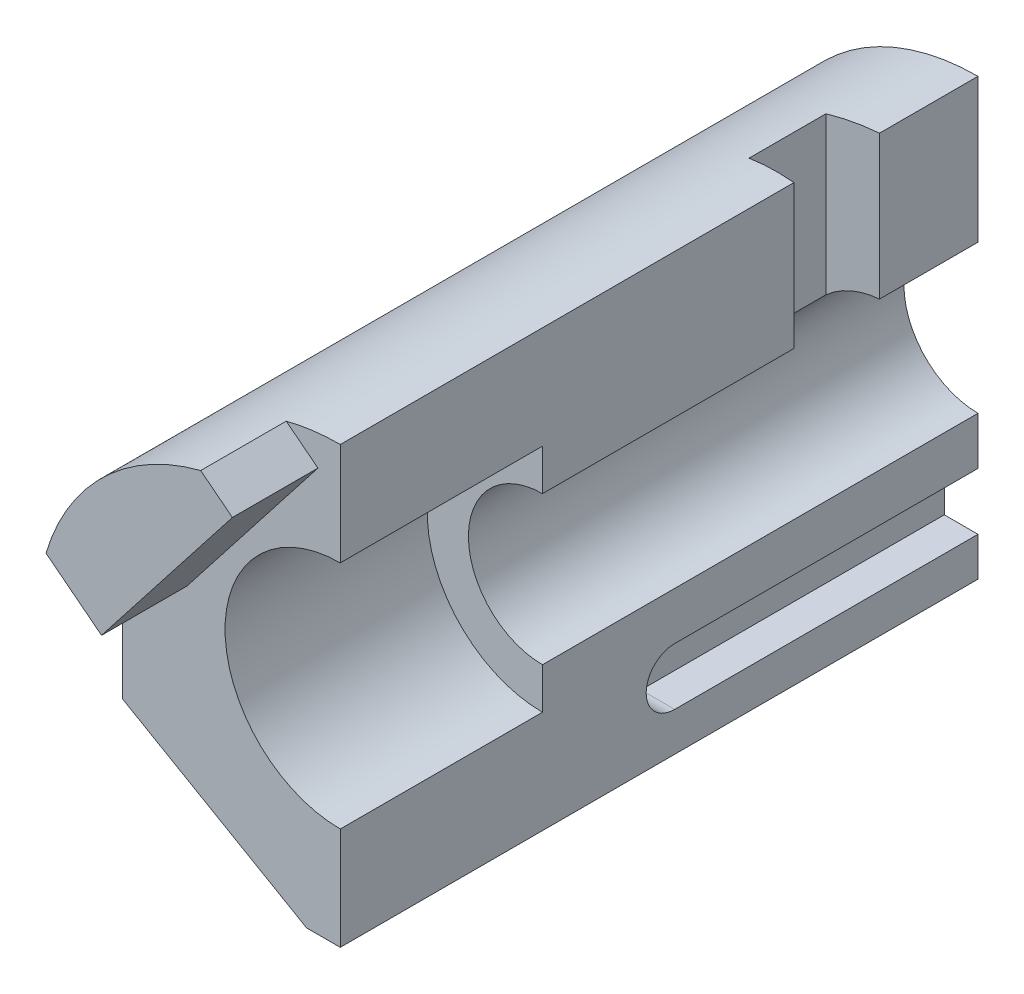
from build123d import *

# Parameters (mm, degrees)
BOSS_EXTRUDE1_DEPTH     = 246
CUT_EXTRUDE1_DEPTH      = 78
BOSS_EXTRUDE2_START     = 33
BOSS_EXTRUDE2_DEPTH     = 33
CUT_EXTRUDE4_DEPTH      = 13
CUT_EXTRUDE5_REACH      = 314.807
CUT_EXTRUDE5_END_RADIUS = 28.575


with BuildPart() as part:
    # Sketch2 → Boss-Extrude1 (new body)
    with BuildSketch(Plane.XY):
        with BuildLine():
            Line((0, -28.575), (0, -84))
            Line((0, -84), (-13, -84))
            Line((-13, -84), (-84, -43.008130888))
            Line((-84, -43.008130888), (-84, 0))
            ThreePointArc((-84, 0), (-59.39696962, 59.39696962), (0, 84))
            Line((0, 84), (0, 28.575))
            ThreePointArc((0, 28.575), (-28.575, 0), (0, -28.575))
        make_face()
    extrude(amount=-BOSS_EXTRUDE1_DEPTH)

    # Sketch3 → Cut-Extrude1 (cut)
    with BuildSketch(Plane.XY):
        with BuildLine():
            Line((0, 44.45), (0, 28.575))
            ThreePointArc((0, 28.575), (-28.575, 0), (0, -28.575))
            Line((0, -28.575), (0, -44.45))
            ThreePointArc((0, -44.45), (-44.45, 0), (0, 44.45))
        make_face()
    extrude(amount=-CUT_EXTRUDE1_DEPTH, mode=Mode.SUBTRACT)

    # Sketch4 → Boss-Extrude2 (add)
    with BuildSketch(Plane.XY.offset(BOSS_EXTRUDE2_START)):
        with BuildLine():
            Line((-20.856290899, 81.369620436), (-8.61759969, 71.807706907))
            Line((-8.61759969, 71.807706907), (-59.101840666, 7.190825111))
            Line((-59.101840666, 7.190825111), (-80.520739305, 23.925102753))
            ThreePointArc((-80.520739305, 23.925102753), (-58.260567421, 60.512034206), (-20.856290899, 81.369620436))
        make_face()
    extrude(amount=-BOSS_EXTRUDE2_DEPTH)

    # Sketch8 → Cut-Extrude4 (cut)
    with BuildSketch(Plane(origin=(0, 0, 0), x_dir=(0, 0, -1), z_dir=(1, 0, 0))):
        with BuildLine():
            Line((246, -47), (129, -47))
            ThreePointArc((129, -47), (118, -58), (129, -69))
            Line((129, -69), (246, -69))
            Line((246, -69), (246, -47))
        make_face()
    extrude(amount=-CUT_EXTRUDE4_DEPTH, mode=Mode.SUBTRACT)

    # Cut-Extrude5: up to this cylinder (the profile starts outside it)
    cut_extrude5_end = Plane(origin=(0, 0, -191.5), z_dir=(0, 0, 1)) * Cylinder(CUT_EXTRUDE5_END_RADIUS, 687.764, mode=Mode.PRIVATE)
    # Sketch9 → Cut-Extrude5 (cut, up to the surface)
    with BuildSketch(Plane(origin=(0, 90, 0), x_dir=(1, 0, 0), z_dir=(0, 1, 0)), mode=Mode.PRIVATE) as cut_extrude5_sk1:
        Polygon((0, 175), (0, 208), (-19, 206.337715393), (-19, 176.662284607), align=None)
    cut_extrude5_tool1 = extrude(cut_extrude5_sk1.sketch, amount=-CUT_EXTRUDE5_REACH, mode=Mode.PRIVATE) - cut_extrude5_end
    add(cut_extrude5_tool1.solids().sort_by_distance((-9.332027, 90, -191.5))[0], mode=Mode.SUBTRACT)


solid = part.part
